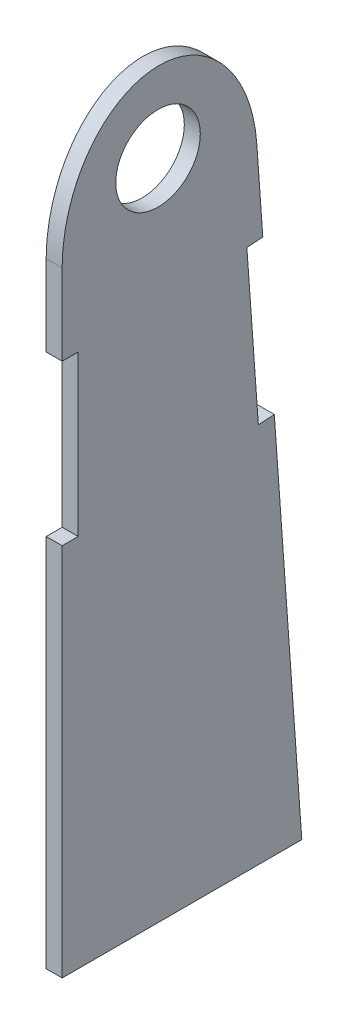
from build123d import *

# Parameters (mm, degrees)
BOSS_EXTRUDE1_DEPTH  = 1.5875
M8_CLEARANCE_HOLE1_D = 8.4
CUT_EXTRUDE1_DEPTH   = 68.327229715


with BuildPart() as part:
    # Sketch1 → Boss-Extrude1 (new body)
    with BuildSketch(Plane(origin=(0, 0, 0), x_dir=(0, 0, -1), z_dir=(1, 0, 0))):
        with BuildLine():
            Line((-9.525, -65.774638339), (0, -65.774638339))
            Line((0, -65.774638339), (14.2875, -65.774638339))
            Line((14.2875, -65.774638339), (11.553356238, -27.816833207))
            Line((11.553356238, -27.816833207), (9.96995864, -27.930887132))
            Line((9.96995864, -27.930887132), (8.829419389, -12.096911155))
            Line((8.829419389, -12.096911155), (10.412816987, -11.98285723))
            Line((10.412816987, -11.98285723), (9.500385586, 0.684323551))
            ThreePointArc((9.500385586, 0.684323551), (-0.342383043, 9.518844407), (-9.525, 0))
            Line((-9.525, 0), (-9.525, -12.7))
            Line((-9.525, -12.7), (-7.9375, -12.7))
            Line((-7.9375, -12.7), (-7.9375, -28.575))
            Line((-7.9375, -28.575), (-9.525, -28.575))
            Line((-9.525, -28.575), (-9.525, -65.774638339))
        make_face()
    extrude(amount=BOSS_EXTRUDE1_DEPTH)

    # M8 Clearance Hole1 (through all)
    with Locations(Plane(origin=(1.5875, 0, 0), x_dir=(0, 0, -1), z_dir=(1, 0, 0))):
        with Locations((0, 0)):
            Hole(M8_CLEARANCE_HOLE1_D / 2)

    # Sketch4 → Cut-Extrude1 (cut, through all)
    with BuildSketch(Plane(origin=(1.5875, 0, 0), x_dir=(0, 0, -1), z_dir=(1, 0, 0))):
        with BuildLine():
            Line((9.813193489, -3.658352794), (9.500385586, 0.684323551))
            ThreePointArc((9.500385586, 0.684323551), (-0.342383043, 9.518844407), (-9.525, 0))
            Line((-9.525, 0), (-9.525, -4.671809667))
            add(Edge.make_bspline(
                [(9.813193489, -3.658352794), (8.943756668, 8.411939147), (-0.290621666, 7.927993001), (-9.525, 7.444046856), (-9.525, -4.671809667)],
                knots=[1.647896538, 1.647896538, 1.647896538, 3.171599371, 3.171599371, 4.695302204, 4.695302204, 4.695302204], degree=2, weights=[1, 0.723559289, 1, 0.723559289, 1]))
        make_face()
    extrude(amount=-CUT_EXTRUDE1_DEPTH, mode=Mode.SUBTRACT)


solid = part.part
